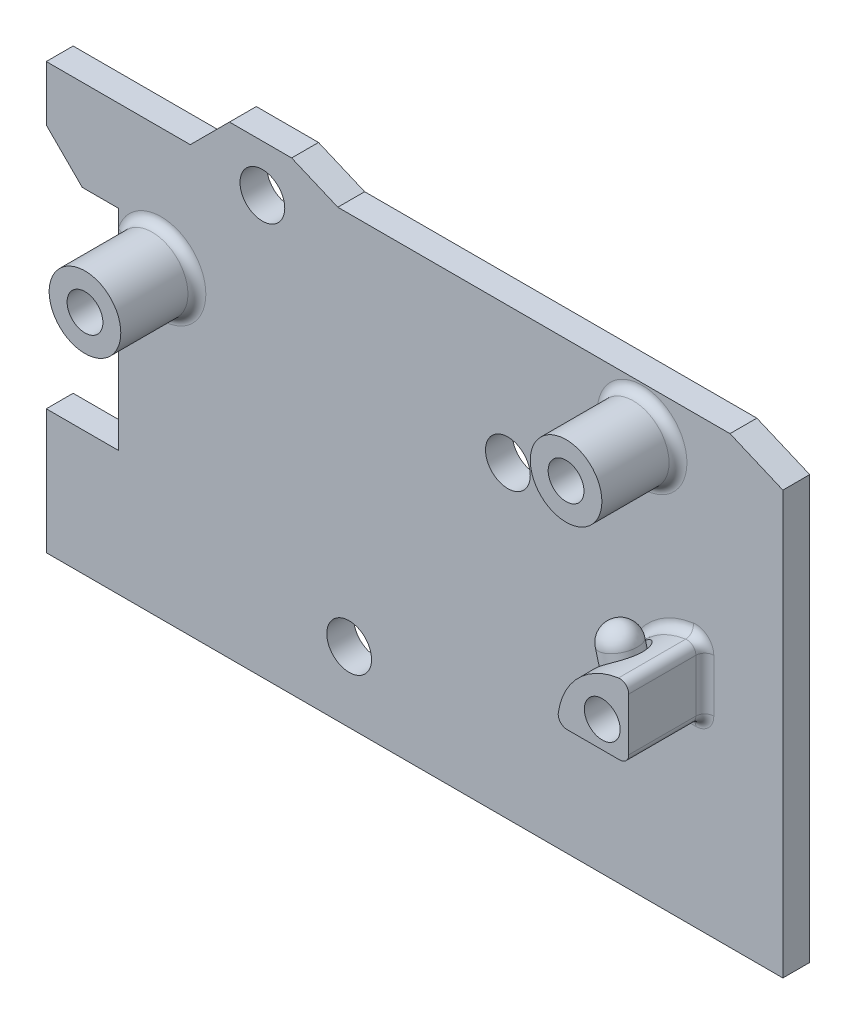
from build123d import *

# Parameters (mm, degrees)
SKETCH_2_R          = 2.5
SKETCH_2_R_2        = 4
EXTRUDE_1_DEPTH     = 3
SKETCH_2_3_R        = 2
SKETCH_2_3_R_2      = 4
EXTRUDE_2_DEPTH     = 11.5
SKETCH_6_R          = 2
EXTRUDE_3_DEPTH     = 2.3
FILLET_1_R          = 2
SKETCH_7_R          = 2.5
SKETCH_7_R_2        = 2
CUT_EXTRUDE_2_DEPTH = 2
FILLET_2_R          = 1


with BuildPart() as part:
    # 스케치2 → 보스-돌출1 (new body)
    with BuildSketch(Plane.XY):
        Polygon((-25.053133429, 21.570131373), (-41.138288377, 21.570131373), (-41.138288377, 15.425110404), (-37.11699964, 11.403821667), (-33.095710903, 11.403821667), (-33.095710903, -12.020899542), (-41.138288377, -12.020899542), (-41.138288377, -25.94560961), (41.138288377, -25.94560961), (41.138288377, 21.251065018), (35.231937864, 23.757870491), (-8.574109119, 23.757870491), (-13.728698976, 25.94560961), (-20.677655191, 25.94560961), align=None)
        with Locations((-7.306059133, -18.107570273)):
            Circle(SKETCH_2_R, mode=Mode.SUBTRACT)
        with BuildLine():
            Line((31.421946091, -5.467040421), (25.543402205, -5.467040421))
            ThreePointArc((25.543402205, -5.467040421), (24.78713928, -5.121308248), (24.553805205, -4.323173199))
            ThreePointArc((24.553805205, -4.323173199), (26.799843583, 0.155062087), (31.278078869, 2.401100465))
            ThreePointArc((31.278078869, 2.401100465), (32.076213917, 2.167766389), (32.421946091, 1.411503465))
            Line((32.421946091, 1.411503465), (32.421946091, -4.467040421))
            ThreePointArc((32.421946091, -4.467040421), (32.129052872, -5.174147202), (31.421946091, -5.467040421))
        make_face(mode=Mode.SUBTRACT)
        with Locations((-28.314407571, 7.976729123)):
            Circle(SKETCH_2_R_2, mode=Mode.SUBTRACT)
        with Locations((-17, 20.7)):
            Circle(SKETCH_2_R, mode=Mode.SUBTRACT)
        with Locations((10.421946091, 8.532959579)):
            Circle(SKETCH_2_R, mode=Mode.SUBTRACT)
        with Locations((25.421946091, 18.532959579)):
            Circle(SKETCH_2_R_2, mode=Mode.SUBTRACT)
    extrude(amount=EXTRUDE_1_DEPTH)

    # 스케치2<3> → 보스-돌출2 (add)
    # profile 1 of 3: a face of its own
    with BuildSketch(Plane.XY):
        with BuildLine():
            ThreePointArc((24.553805205, -4.323173199), (24.78713928, -5.121308248), (25.543402205, -5.467040421))
            Line((25.543402205, -5.467040421), (31.421946091, -5.467040421))
            ThreePointArc((31.421946091, -5.467040421), (32.129052872, -5.174147202), (32.421946091, -4.467040421))
            Line((32.421946091, -4.467040421), (32.421946091, 1.411503465))
            ThreePointArc((32.421946091, 1.411503465), (32.076213917, 2.167766389), (31.278078869, 2.401100465))
            ThreePointArc((31.278078869, 2.401100465), (26.799843583, 0.155062087), (24.553805205, -4.323173199))
        make_face()
        with Locations((29.464448227, -2.509542558)):
            Circle(SKETCH_2_3_R, mode=Mode.SUBTRACT)
    # profile 2 of 3: a face of its own
    with BuildSketch(Plane.XY):
        with Locations((-28.314407571, 7.976729123)):
            Circle(SKETCH_2_3_R_2)
        with Locations((-28.314407571, 7.976729123)):
            Circle(SKETCH_2_3_R, mode=Mode.SUBTRACT)
    # profile 3 of 3: a face of its own
    with BuildSketch(Plane.XY):
        with Locations((25.421946091, 18.532959579)):
            Circle(SKETCH_2_3_R_2)
        with Locations((25.421946091, 18.532959579)):
            Circle(SKETCH_2_3_R, mode=Mode.SUBTRACT)
    extrude(amount=EXTRUDE_2_DEPTH)

    # 스케치6 → 보스-돌출3 (add, symmetric)
    with BuildSketch(Plane(origin=(1.480786333, -5.526369829, 0), x_dir=(0, 0, 1), z_dir=(-0.25881904510252574, 0.9659258262890671, 0))):
        with Locations((7.25, 26.715994864)):
            Circle(SKETCH_6_R)
    extrude(amount=EXTRUDE_3_DEPTH, both=True)

    # 필렛1
    fillet_1_edges = [part.edges().sort_by_distance(p)[0] for p in [
        (26.691171943, 3.609867851, 5.25),
    ]]
    fillet(fillet_1_edges, radius=FILLET_1_R)

    # 스케치7 → 컷-돌출2 (cut)
    with BuildSketch(Plane(origin=(1.480786333, -5.526369829, 0), x_dir=(0, 0, 1), z_dir=(-0.25881904510252574, 0.9659258262890671, 0))):
        with Locations((7.25, 26.715994864)):
            Circle(SKETCH_7_R)
        with Locations((7.25, 26.715994864)):
            Circle(SKETCH_7_R_2, mode=Mode.SUBTRACT)
    extrude(amount=-CUT_EXTRUDE_2_DEPTH, mode=Mode.SUBTRACT)

    # 필렛2
    fillet_2_edges = [part.edges().sort_by_distance(p)[0] for p in [
        (32.076213917, 2.167766389, 3),
        (32.421946091, -1.527768478, 3),
        (32.129052872, -5.174147202, 3),
        (28.482674148, -5.467040421, 3),
        (24.78713928, -5.121308248, 3),
        (-32.314407571, 7.976729123, 3),
        (21.421946091, 18.532959579, 3),
        (26.799843583, 0.155062087, 3),
    ]]
    fillet(fillet_2_edges, radius=FILLET_2_R)


solid = part.part
